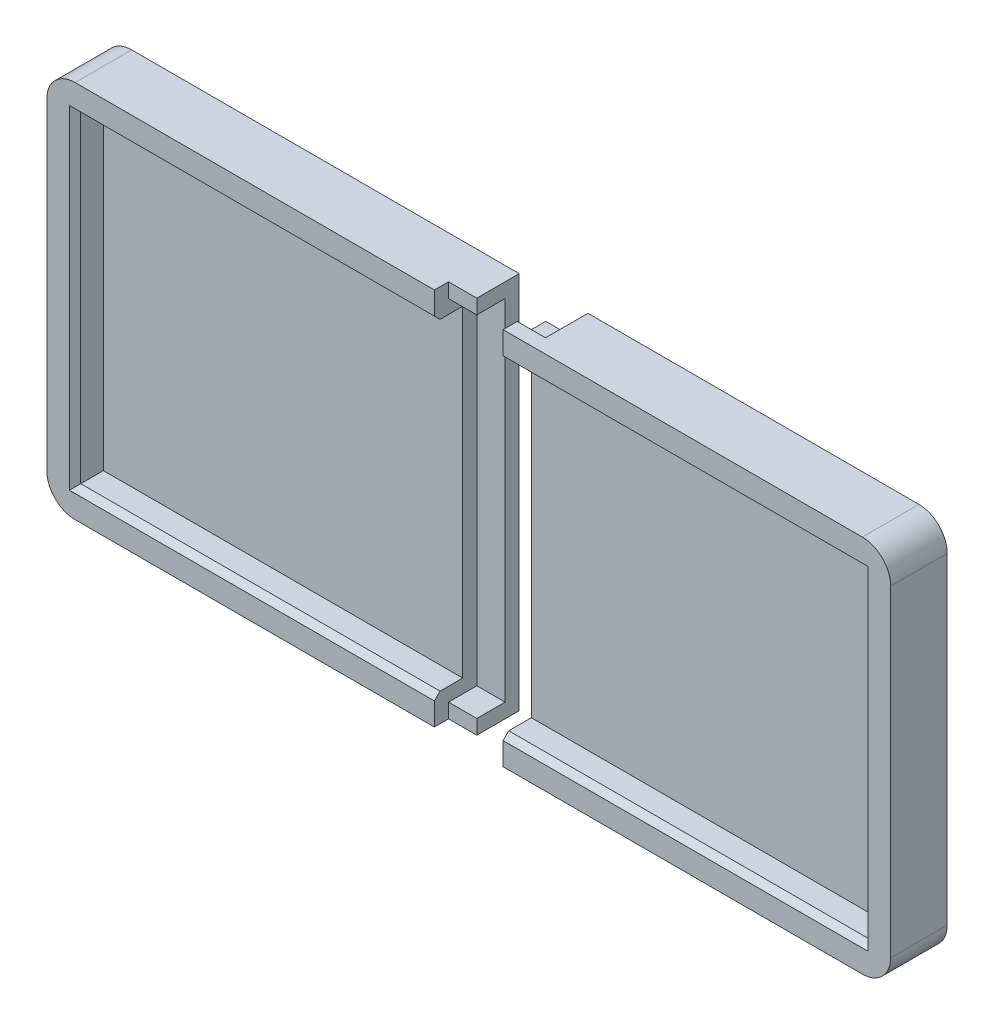
from build123d import *

# Parameters (mm, degrees)
BOSS_EXTRUDE1_DEPTH = 12.7
SKETCH2_W           = 173.99
SKETCH2_H           = 169.926
BOSS_EXTRUDE2_DEPTH = 12.7
FILLET1_R           = 12.7
FILLET2_SIZE        = 2.54
BOSS_EXTRUDE5_DEPTH = 12.7
BOSS_EXTRUDE6_DEPTH = 12.7
SKETCH8_W           = 173.99
SKETCH8_H           = 169.926
BOSS_EXTRUDE7_DEPTH = 12.7
CUT_EXTRUDE1_DEPTH  = 12.7
CHAMFER1_SIZE       = 2.54
FILLET4_R           = 12.7


with BuildPart() as part:
    # Sketch1 → Boss-Extrude1 (new body)
    with BuildSketch(Plane.XY):
        Polygon((-80.645, 72.263), (80.645, 72.263), (80.645, 84.963), (-93.345, 84.963), (-93.345, -84.963), (80.645, -84.963), (80.645, -72.263), (-80.645, -72.263), align=None)
    extrude(amount=BOSS_EXTRUDE1_DEPTH)

    # Sketch2 → Boss-Extrude2 (add)
    with BuildSketch(Plane(origin=(0, 0, 0), x_dir=(-1, 0, 0), z_dir=(0, 0, -1))):
        with Locations((6.35, 0)):
            Rectangle(SKETCH2_W, SKETCH2_H)
    extrude(amount=BOSS_EXTRUDE2_DEPTH)

    # Fillet1
    fillet1_edges = [part.edges().sort_by_distance(p)[0] for p in [
        (-93.345, -84.963, 0),
        (-93.345, 84.963, 0),
    ]]
    fillet(fillet1_edges, radius=FILLET1_R)

    # Fillet2
    fillet2_edges = [part.edges().sort_by_distance(p)[0] for p in [
        (0, -72.263, 12.7),
        (-80.645, 0, 12.7),
        (0, 72.263, 12.7),
    ]]
    chamfer(fillet2_edges, length=FILLET2_SIZE)

    # Sketch6 → Boss-Extrude5 (add)
    with BuildSketch(Plane(origin=(80.645, 0, 0), x_dir=(0, 0, -1), z_dir=(1, 0, 0))):
        Polygon((-6.35, 84.963), (12.7, 84.963), (12.7, 65.913), (12.7, -65.913), (12.7, -84.963), (-6.35, -84.963), (-6.35, -78.445226504), (6.35, -78.445226504), (6.35, -65.659), (6.35, 65.659), (6.35, 78.445226504), (-6.35, 78.445226504), align=None)
    extrude(amount=BOSS_EXTRUDE5_DEPTH)


with BuildPart() as body_2:
    # Sketch7 → Boss-Extrude6 (new body)
    with BuildSketch(Plane.XY):
        Polygon((285.472121408, 84.963), (111.482121408, 84.963), (111.482121408, 72.263), (272.772121408, 72.263), (272.772121408, -72.263), (111.482121408, -72.263), (111.482121408, -84.963), (285.472121408, -84.963), align=None)
    extrude(amount=BOSS_EXTRUDE6_DEPTH)

    # Sketch8 → Boss-Extrude7 (add)
    with BuildSketch(Plane(origin=(0, 0, 0), x_dir=(-1, 0, 0), z_dir=(0, 0, -1))):
        with Locations((-198.477121408, 0)):
            Rectangle(SKETCH8_W, SKETCH8_H)
    extrude(amount=BOSS_EXTRUDE7_DEPTH)

    # Sketch9 → Cut-Extrude1 (cut)
    with BuildSketch(Plane.ZY.offset(-111.482121408)):
        Polygon((-12.7, 84.963), (6.35, 84.963), (6.35, 78.613), (-6.454227482, 78.613), (-6.454227482, -78.613), (6.35, -78.613), (6.35, -84.963), (-12.7, -84.963), align=None)
    extrude(amount=-CUT_EXTRUDE1_DEPTH, mode=Mode.SUBTRACT)

    # Chamfer1
    chamfer1_edges = [body_2.edges().sort_by_distance(p)[0] for p in [
        (272.772121408, 0, 12.7),
        (192.127121408, -72.263, 12.7),
        (192.127121408, 72.263, 12.7),
    ]]
    chamfer(chamfer1_edges, length=CHAMFER1_SIZE)

    # Fillet4
    fillet4_edges = [body_2.edges().sort_by_distance(p)[0] for p in [
        (285.472121408, 84.963, 0),
        (285.472121408, -84.963, 0),
    ]]
    fillet(fillet4_edges, radius=FILLET4_R)


solid = Compound([part.part, body_2.part])
